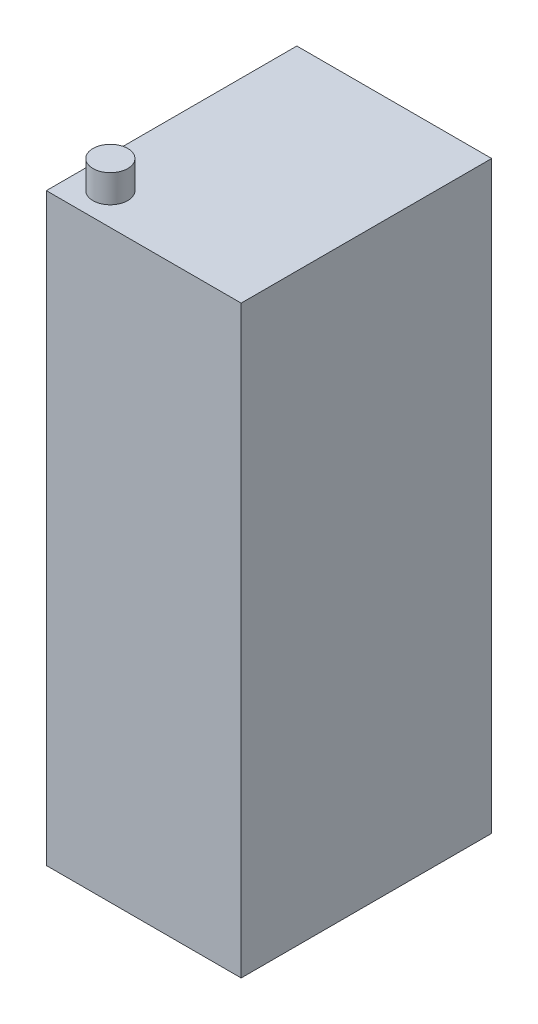
from build123d import *

# Parameters (mm, degrees)
SKETCH1_W             = 70
SKETCH1_H             = 210
LV_BATTRY_DEPTH       = 90
SKETCH2_R             = 6.25
CABLES_3X_14AWG_DEPTH = 10


with BuildPart() as part:
    # Sketch1 → LV Battry (new body)
    with BuildSketch(Plane.XY):
        with Locations((-86.457724765, 45.558894231)):
            Rectangle(SKETCH1_W, SKETCH1_H)
    extrude(amount=LV_BATTRY_DEPTH)

    # Sketch2 → Cables (3x 14AWG) (add)
    with BuildSketch(Plane(origin=(0, 150.558894231, 0), x_dir=(1, 0, 0), z_dir=(0, 1, 0))):
        with Locations(Location((-109.957724765, -78.5, 0), (0, 0, 90))):
            Circle(SKETCH2_R)
    extrude(amount=CABLES_3X_14AWG_DEPTH)


solid = part.part
